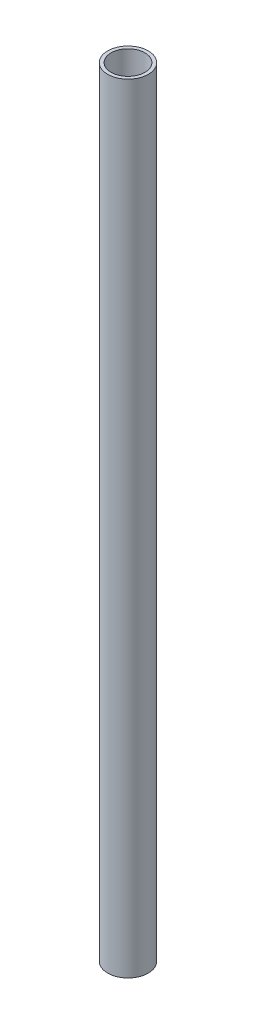
from build123d import *

# Parameters (mm, degrees)
SKETCH_1_R      = 6
SKETCH_1_R_2    = 5
EXTRUDE_1_DEPTH = 230


with BuildPart() as part:
    # 草图1 → 凸台-拉伸1 (new body)
    with BuildSketch(Plane(origin=(0, 0, 0), x_dir=(1, 0, 0), z_dir=(0, 1, 0))):
        with Locations(Location((0, 0, 0), (0, 0, 270))):
            Circle(SKETCH_1_R)
        with Locations(Location((0, 0, 0), (0, 0, 270))):
            Circle(SKETCH_1_R_2, mode=Mode.SUBTRACT)
    extrude(amount=EXTRUDE_1_DEPTH)


solid = part.part
